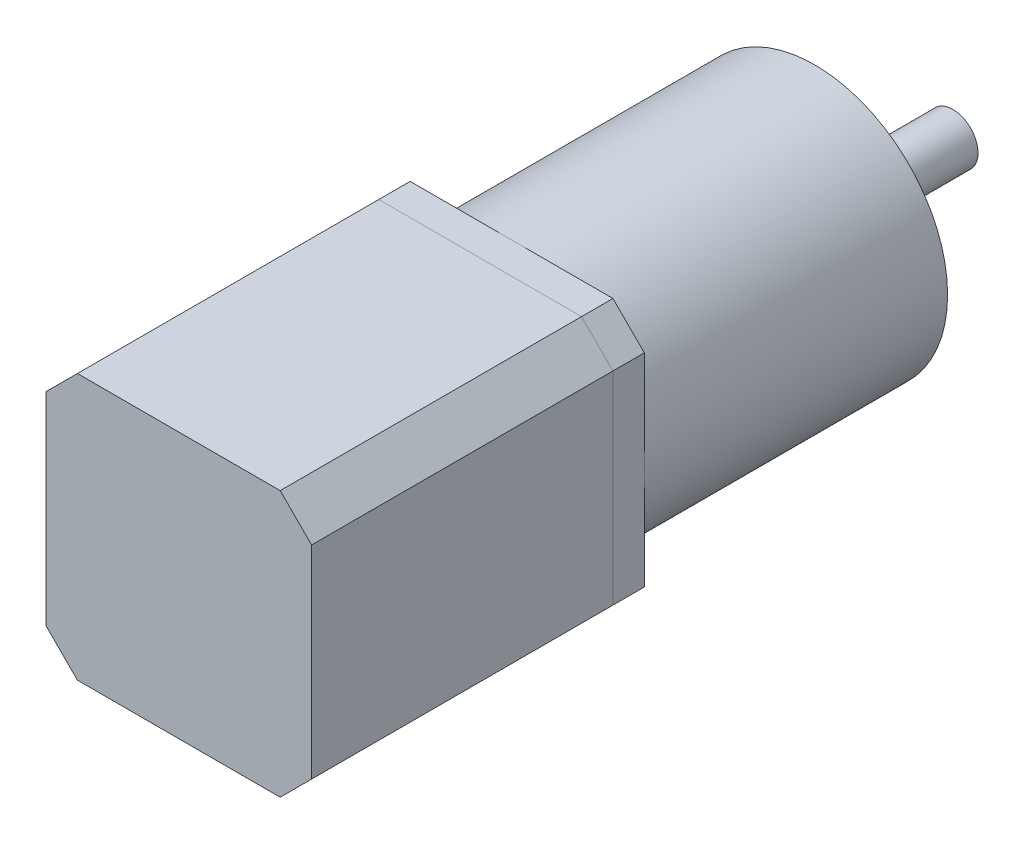
from build123d import *

# Parameters (mm, degrees)
SKETCH1_W           = 42.3
SKETCH1_H           = 42.3
BOSS_EXTRUDE1_DEPTH = 48
CHAMFER1_SIZE       = 5
SKETCH2_W           = 42.3
SKETCH2_H           = 42.3
BOSS_EXTRUDE2_DEPTH = 5
CHAMFER2_SIZE       = 5
SKETCH3_R           = 21.15
BOSS_EXTRUDE3_DEPTH = 48.3
SKETCH4_R           = 11
BOSS_EXTRUDE4_DEPTH = 2
SKETCH5_R           = 4
BOSS_EXTRUDE5_DEPTH = 20
SKETCH6_R           = 6.210975092
BOSS_EXTRUDE6_DEPTH = 0.5
SKETCH7_R           = 1.5
CUT_EXTRUDE2_DEPTH  = 10


with BuildPart() as part:
    # Sketch1 → Boss-Extrude1 (new body)
    with BuildSketch(Plane.XY):
        Rectangle(SKETCH1_W, SKETCH1_H)
    extrude(amount=BOSS_EXTRUDE1_DEPTH)

    # Chamfer1
    chamfer1_edges = [part.edges().sort_by_distance(p)[0] for p in [
        (21.15, -21.15, 24),
        (-21.15, -21.15, 24),
        (-21.15, 21.15, 24),
        (21.15, 21.15, 24),
    ]]
    chamfer(chamfer1_edges, length=CHAMFER1_SIZE)


with BuildPart() as body_2:
    # Sketch2 → Boss-Extrude2 (new body)
    with BuildSketch(Plane(origin=(0, 0, 0), x_dir=(-1, 0, 0), z_dir=(0, 0, -1))):
        Rectangle(SKETCH2_W, SKETCH2_H)
    extrude(amount=BOSS_EXTRUDE2_DEPTH)

    # Chamfer2
    chamfer2_edges = [body_2.edges().sort_by_distance(p)[0] for p in [
        (-21.15, -21.15, -2.5),
        (21.15, -21.15, -2.5),
        (21.15, 21.15, -2.5),
        (-21.15, 21.15, -2.5),
    ]]
    chamfer(chamfer2_edges, length=CHAMFER2_SIZE)


with BuildPart() as body_3:
    # Sketch3 → Boss-Extrude3 (new body)
    with BuildSketch(Plane(origin=(0, 0, -5), x_dir=(-1, 0, 0), z_dir=(0, 0, -1))):
        with Locations(Location((0, 0, 0), (0, 0, 180))):
            Circle(SKETCH3_R)
    extrude(amount=BOSS_EXTRUDE3_DEPTH)

    # Sketch7 → Cut-Extrude2 (cut)
    with BuildSketch(Plane(origin=(0, 0, -53.3), x_dir=(-1, 0, 0), z_dir=(0, 0, -1))):
        with Locations((-17.5, 0)):
            Circle(SKETCH7_R)
        with Locations((0, 17.5)):
            Circle(SKETCH7_R)
        with Locations((17.5, 0)):
            Circle(SKETCH7_R)
        with Locations((0, -17.5)):
            Circle(SKETCH7_R)
    extrude(amount=-CUT_EXTRUDE2_DEPTH, mode=Mode.SUBTRACT)


with BuildPart() as body_4:
    # Sketch4 → Boss-Extrude4 (new body)
    with BuildSketch(Plane(origin=(0, 0, -53.3), x_dir=(-1, 0, 0), z_dir=(0, 0, -1))):
        Circle(SKETCH4_R)
    extrude(amount=BOSS_EXTRUDE4_DEPTH)


with BuildPart() as body_5:
    # Sketch5 → Boss-Extrude5 (new body)
    with BuildSketch(Plane(origin=(0, 0, -55.3), x_dir=(-1, 0, 0), z_dir=(0, 0, -1))):
        Circle(SKETCH5_R)
    extrude(amount=BOSS_EXTRUDE5_DEPTH)


with BuildPart() as body_6:
    # Sketch6 → Boss-Extrude6 (new body)
    with BuildSketch(Plane(origin=(0, 0, -55.3), x_dir=(-1, 0, 0), z_dir=(0, 0, -1))):
        Circle(SKETCH6_R)
    extrude(amount=BOSS_EXTRUDE6_DEPTH)


solid = Compound([part.part, body_2.part, body_3.part, body_4.part, body_5.part, body_6.part])
